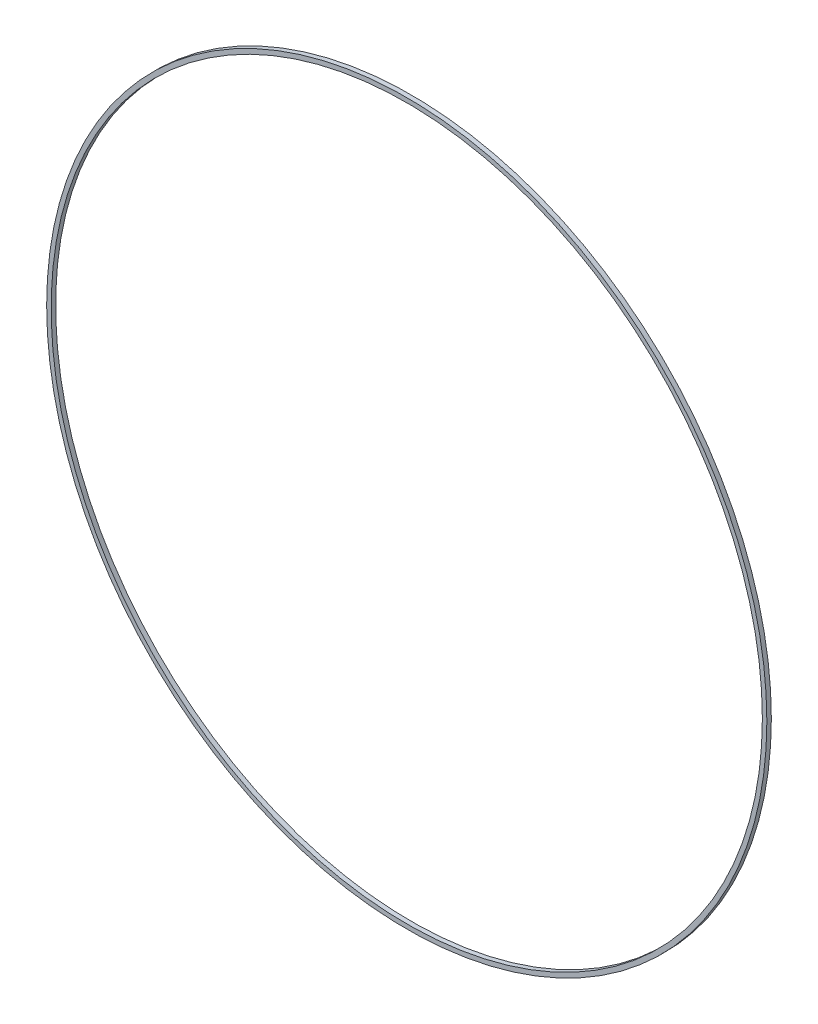
from build123d import *

# Parameters (mm, degrees)
SKETCH1_R           = 101.671804802
SKETCH1_R_2         = 100.401804802
BOSS_EXTRUDE1_DEPTH = 1.27


with BuildPart() as part:
    # Sketch1 → Boss-Extrude1 (new body)
    with BuildSketch(Plane.XY):
        with Locations((-24.852581419, 9.230370399)):
            Circle(SKETCH1_R)
        with Locations((-24.852581419, 9.230370399)):
            Circle(SKETCH1_R_2, mode=Mode.SUBTRACT)
    extrude(amount=BOSS_EXTRUDE1_DEPTH)


solid = part.part
